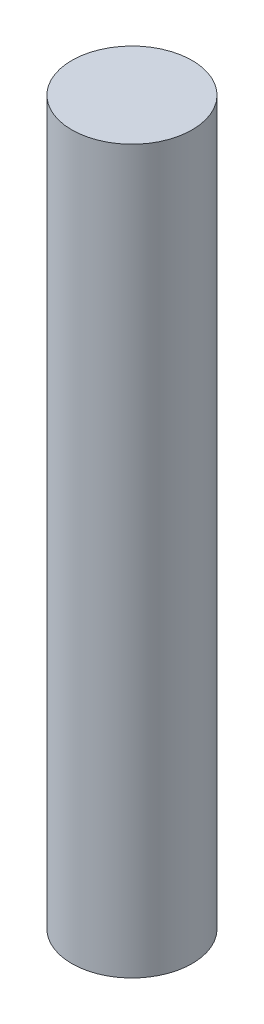
from build123d import *

# Parameters (mm, degrees)
CROQUIS1_R              = 25
SALIENTE_EXTRUIR1_DEPTH = 300


with BuildPart() as part:
    # Croquis1 → Saliente-Extruir1 (new body)
    with BuildSketch(Plane(origin=(0, 0, 0), x_dir=(1, 0, 0), z_dir=(0, 1, 0))):
        with Locations(Location((0, 0, 0), (0, 0, 270))):
            Circle(CROQUIS1_R)
    extrude(amount=SALIENTE_EXTRUIR1_DEPTH)


solid = part.part
